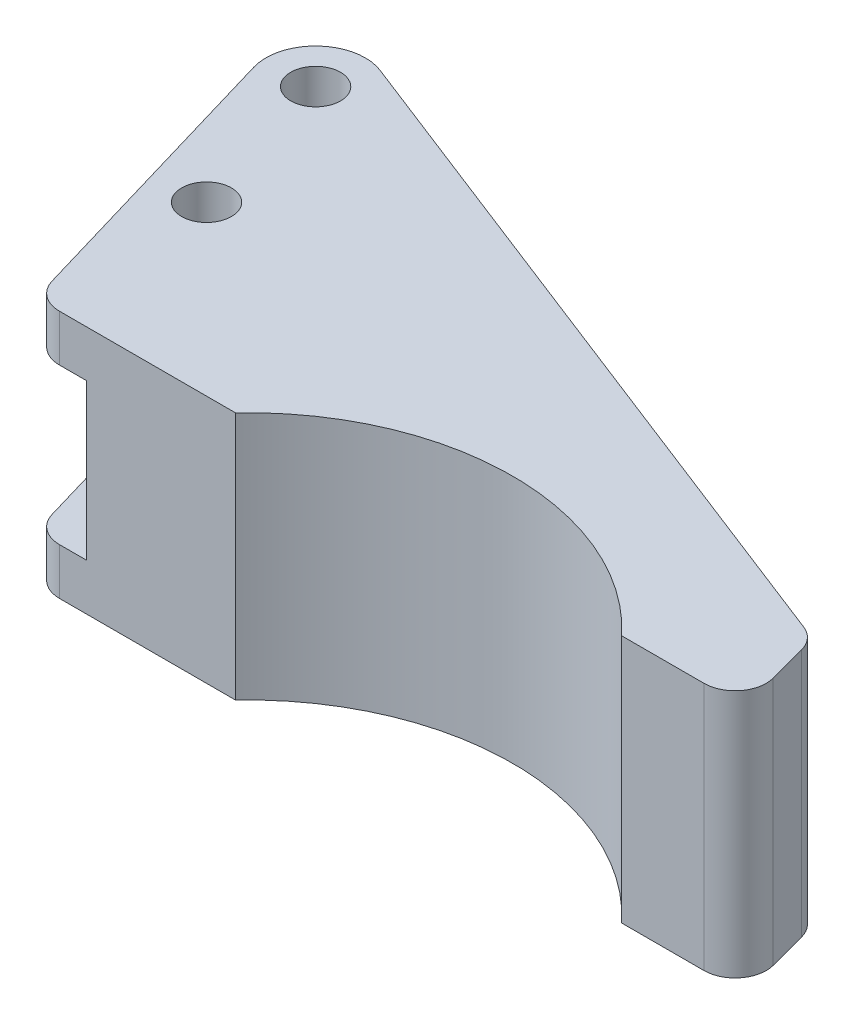
from build123d import *

# Parameters (mm, degrees)
SKETCH1_R           = 4
BOSS_EXTRUDE1_DEPTH = 40
SKETCH2_W           = 23
SKETCH2_H           = 25
CUT_EXTRUDE1_DEPTH  = 101.058107917


with BuildPart() as part:
    # Sketch1 → Boss-Extrude1 (new body)
    with BuildSketch(Plane(origin=(0, 0, 0), x_dir=(1, 0, 0), z_dir=(0, 1, 0))):
        with BuildLine():
            Line((39.60733846, 0), (52.847209838, 0))
            ThreePointArc((52.847209838, 0), (56.811389388, 1.952824177), (57.67903067, 6.285887802))
            Line((57.67903067, 6.285887802), (56.02903067, 12.485887802))
            ThreePointArc((56.02903067, 12.485887802), (54.923989844, 14.533333284), (53.012004514, 15.85902568))
            Line((53.012004514, 15.85902568), (-58.57444061, 59.324441087))
            ThreePointArc((-58.57444061, 59.324441087), (-66.890236963, 57.761426345), (-69.151600504, 49.607794087))
            Line((-69.151600504, 49.607794087), (-55.584042349, 3.586121305))
            ThreePointArc((-55.584042349, 3.586121305), (-53.782323718, 0.995665256), (-50.788112092, 0))
            Line((-50.788112092, 0), (-22.483562644, 0))
            ThreePointArc((-22.483562644, 0), (8.561887908, 13.48), (39.60733846, 0))
        make_face()
        with Locations(Location((-61.478112092, 51.87, 0), (0, 0, 270))):
            Circle(SKETCH1_R, mode=Mode.SUBTRACT)
        with Locations(Location((-54.148112092, 27, 0), (0, 0, 270))):
            Circle(SKETCH1_R, mode=Mode.SUBTRACT)
    extrude(amount=BOSS_EXTRUDE1_DEPTH)

    # Sketch2 → Cut-Extrude1 (cut, through all)
    with BuildSketch(Plane.XY):
        with Locations((-57.978112092, 20)):
            Rectangle(SKETCH2_W, SKETCH2_H)
    extrude(amount=-CUT_EXTRUDE1_DEPTH, mode=Mode.SUBTRACT)


solid = part.part
